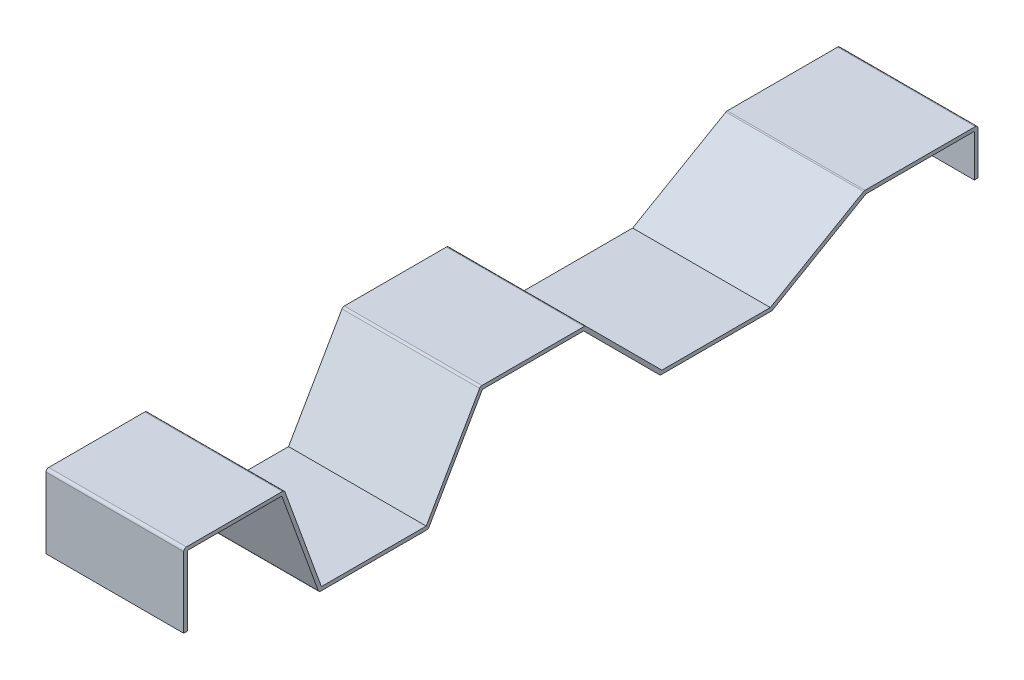
from build123d import *

# Parameters (mm, degrees)
BOSS_EXTRUDE1_DEPTH = 76.2
FILLET1_R           = 1.5
FILLET2_R           = 1.5
FILLET3_R           = 0.5


with BuildPart() as part:
    # Sketch1 → Boss-Extrude1 (new body)
    with BuildSketch(Plane(origin=(0, 0, 0), x_dir=(0, 0, -1), z_dir=(1, 0, 0))):
        Polygon((410.975974775, -727.738016425), (410.975974775, -702.338016425), (347.983974775, -702.338016425), (296.022450548, -732.338016425), (236.022450548, -732.338016425), (193.596043677, -689.911609554), (135.596043677, -689.911609554), (105.596043677, -741.873133781), (47.596043677, -741.873133781), (27.074835078, -685.491576534), (-28.635164922, -685.491576534), (-28.635164922, -726.131576534), (-26.635164922, -726.131576534), (-26.635164922, -687.491576534), (25.674420001, -687.491576534), (46.195628601, -743.873133781), (106.695628601, -743.873133781), (136.695628601, -691.911609554), (192.695628601, -691.911609554), (235.122035472, -734.338016425), (297.01444362, -734.338016425), (348.975974775, -704.338012425), (408.975974775, -704.338012425), (408.975974775, -727.738016425), align=None)
    extrude(amount=BOSS_EXTRUDE1_DEPTH)

    # Fillet1
    fillet1_edges = [part.edges().sort_by_distance(p)[0] for p in [
        (38.1, -685.491576534, 28.635164922),
        (38.1, -685.491576534, -27.074835078),
        (38.1, -689.911609554, -135.596043677),
        (38.1, -689.911609554, -193.596043677),
        (38.1, -702.338016425, -347.983974775),
        (38.1, -702.338016425, -410.975974775),
    ]]
    fillet(fillet1_edges, radius=FILLET1_R)

    # Fillet2
    fillet2_edges = [part.edges().sort_by_distance(p)[0] for p in [
        (38.1, -734.338016425, -297.01444362),
        (38.1, -734.338016425, -235.122035472),
        (38.1, -743.873133781, -106.695628601),
        (38.1, -743.873133781, -46.195628601),
    ]]
    fillet(fillet2_edges, radius=FILLET2_R)

    # Fillet3
    fillet3_edges = [part.edges().sort_by_distance(p)[0] for p in [
        (38.1, -704.338012425, -408.975974775),
        (38.1, -704.338012425, -348.975974775),
        (38.1, -691.911609554, -192.695628601),
        (38.1, -691.911609554, -136.695628601),
        (38.1, -687.491576534, -25.674420001),
        (38.1, -687.491576534, 26.635164922),
    ]]
    fillet(fillet3_edges, radius=FILLET3_R)


solid = part.part
